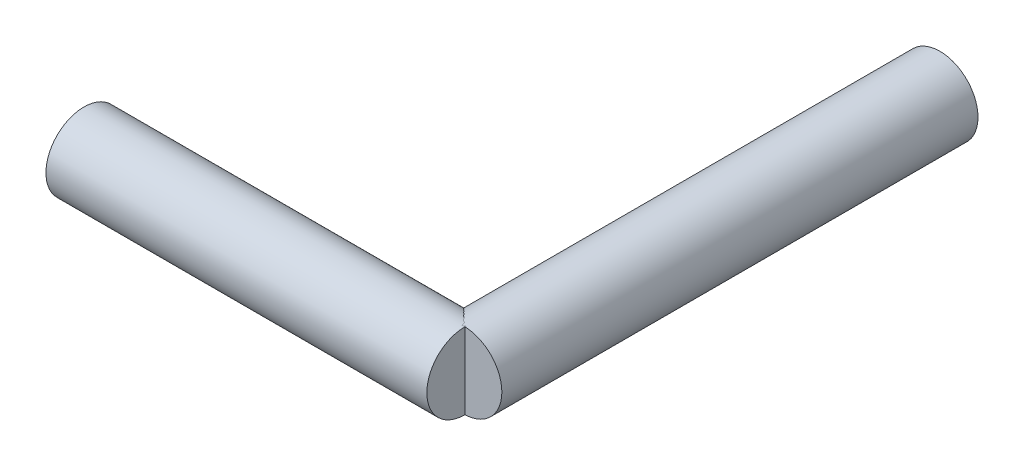
from build123d import *

# Parameters (mm, degrees)
SKIZZE3_R       = 8
MOTORARM_DEPTH  = 80
SKIZZE4_R       = 8
PENDELARM_DEPTH = 100


with BuildPart() as part:
    # Skizze3 → Motorarm (new body)
    with BuildSketch(Plane.YZ):
        with Locations(Location((0, 0, 0), (0, 0, 270))):
            Circle(SKIZZE3_R)
    extrude(amount=MOTORARM_DEPTH)


with BuildPart() as body_2:
    # Skizze4 → Pendelarm (new body)
    with BuildSketch(Plane(origin=(0, 0, 0), x_dir=(0, 1, 0), z_dir=(0, 0, 1))):
        with Locations(Location((0, -79.756912817, 0), (0, 0, 270))):
            Circle(SKIZZE4_R)
    extrude(amount=-PENDELARM_DEPTH)


solid = Compound([part.part, body_2.part])
